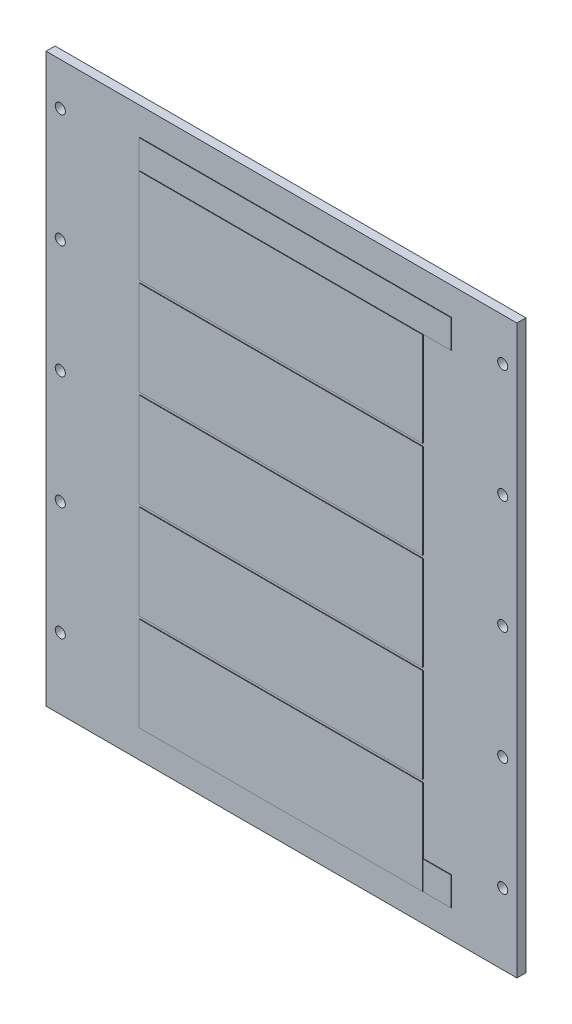
from build123d import *

# Parameters (mm, degrees)
SKETCH1_W                 = 83
SKETCH1_H                 = 100
BOSS_EXTRUDE1_DEPTH       = 1.5875
F_0_CLEARANCE_HOLE1_D     = 1.778
F_0_CLEARANCE_HOLE1_DEPTH = 3.175
F_0_CLEARANCE_HOLE1_TIP   = 0.53416509
SKETCH5_W                 = 50
SKETCH5_H                 = 16.6
BOSS_EXTRUDE3_DEPTH       = 0.1
SKETCH6_W                 = 55
SKETCH6_H                 = 5
BOSS_EXTRUDE4_DEPTH       = 0.1
SKETCH7_W                 = 4.99
SKETCH7_H                 = 5
BOSS_EXTRUDE5_DEPTH       = 0.1


with BuildPart() as part:
    # Sketch1 → Boss-Extrude1 (new body)
    with BuildSketch(Plane.XY):
        Rectangle(SKETCH1_W, SKETCH1_H)
    extrude(amount=BOSS_EXTRUDE1_DEPTH)

    # #0 Clearance Hole1
    with Locations(Plane.XY.offset(1.5875)):
        with Locations((-39, 42.5), (-39, 22.5), (-39, 2.5), (-39, -17.5), (-39, -37.5), (39, -37.5), (39, -17.5), (39, 2.5), (39, 22.5), (39, 42.5)):
            Hole(F_0_CLEARANCE_HOLE1_D / 2, depth=F_0_CLEARANCE_HOLE1_DEPTH)
            with Locations((0, 0, -(F_0_CLEARANCE_HOLE1_DEPTH + F_0_CLEARANCE_HOLE1_TIP / 2))):  # 118° drill point
                Cone(0, F_0_CLEARANCE_HOLE1_D / 2, F_0_CLEARANCE_HOLE1_TIP, mode=Mode.SUBTRACT)

    # Sketch5 → Boss-Extrude3 (add)
    with BuildSketch(Plane.XY.offset(1.5875)):
        with Locations((0, 14.6)):
            Rectangle(SKETCH5_W, SKETCH5_H)
        with Locations((0, 31.7)):
            Rectangle(SKETCH5_W, SKETCH5_H)
        with Locations((0, -2.5)):
            Rectangle(SKETCH5_W, SKETCH5_H)
        with Locations((0, -19.6)):
            Rectangle(SKETCH5_W, SKETCH5_H)
        with Locations((0, -36.7)):
            Rectangle(SKETCH5_W, SKETCH5_H)
    extrude(amount=BOSS_EXTRUDE3_DEPTH)

    # Sketch6 → Boss-Extrude4 (add)
    with BuildSketch(Plane.XY.offset(1.5875)):
        with Locations((2.5, 42.6)):
            Rectangle(SKETCH6_W, SKETCH6_H)
    extrude(amount=BOSS_EXTRUDE4_DEPTH)

    # Sketch7 → Boss-Extrude5 (add)
    with BuildSketch(Plane.XY.offset(1.5875)):
        with Locations((27.505, -42.5)):
            Rectangle(SKETCH7_W, SKETCH7_H)
    extrude(amount=BOSS_EXTRUDE5_DEPTH)


solid = part.part
